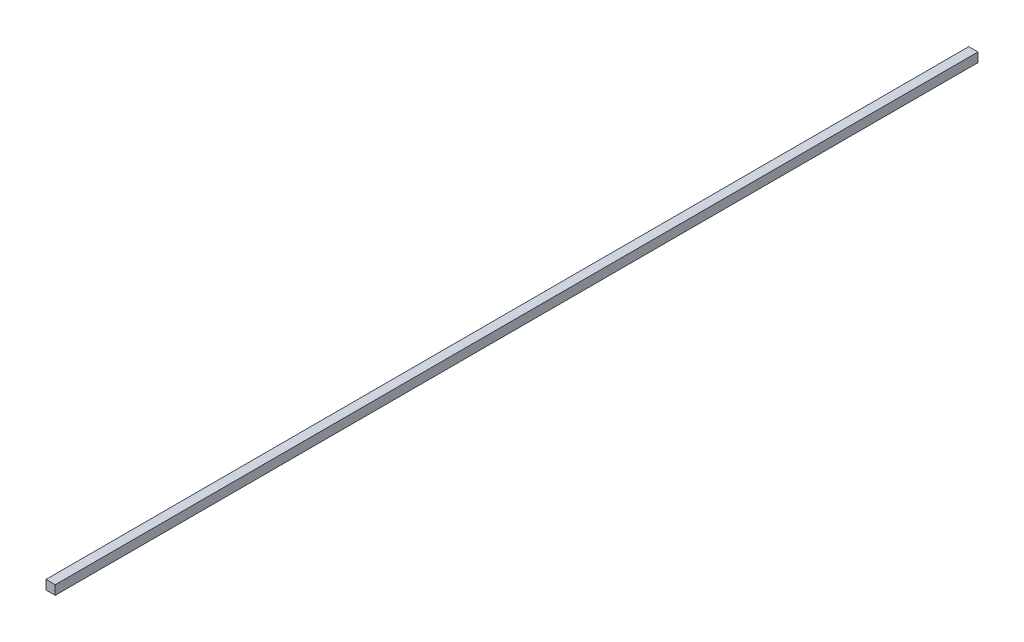
from build123d import *

# Parameters (mm, degrees)
SKETCH_1_W      = 10
SKETCH_1_H      = 10
EXTRUDE_1_DEPTH = 1000


with BuildPart() as part:
    # ｽｹｯﾁ1 → ﾎﾞｽ - 押し出し1 (new body)
    with BuildSketch(Plane.XY):
        with Locations((-5, -5)):
            Rectangle(SKETCH_1_W, SKETCH_1_H)
    extrude(amount=EXTRUDE_1_DEPTH)


solid = part.part
